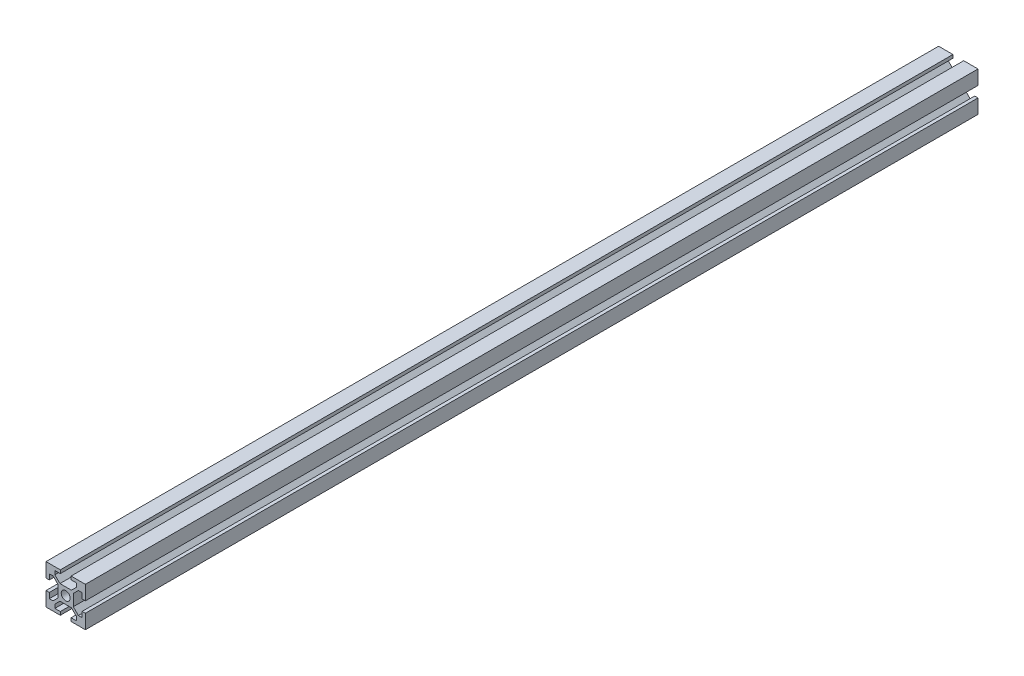
from build123d import *

# Parameters (mm, degrees)
SKETCH_1_R      = 3.4
EXTRUDE_1_DEPTH = 680


with BuildPart() as part:
    # 草图1 → 凸台-拉伸1 (new body)
    with BuildSketch(Plane.XY):
        Polygon((-4.1, 12.5), (-4.1, 15), (-8.25, 15), (-15, 15), (-15, 8.25), (-15, 4.1), (-12.5, 4.1), (-12.5, 8.25), (-9.664213562, 8.25), (-5.8, 4.385786438), (-5.8, -4.385786438), (-9.664213562, -8.25), (-12.5, -8.25), (-12.5, -4.1), (-15, -4.1), (-15, -8.25), (-15, -15), (-8.25, -15), (-4.1, -15), (-4.1, -12.5), (-8.25, -12.5), (-8.25, -9.664213562), (-4.385786438, -5.8), (4.385786438, -5.8), (8.25, -9.664213562), (8.25, -12.5), (4.1, -12.5), (4.1, -15), (8.25, -15), (15, -15), (15, -8.25), (15, -4.1), (12.5, -4.1), (12.5, -8.25), (9.664213562, -8.25), (5.8, -4.385786438), (5.8, 4.385786438), (9.664213562, 8.25), (12.5, 8.25), (12.5, 4.1), (15, 4.1), (15, 8.25), (15, 15), (8.25, 15), (4.1, 15), (4.1, 12.5), (8.25, 12.5), (8.25, 9.664213562), (4.385786438, 5.8), (-4.385786438, 5.8), (-8.25, 9.664213562), (-8.25, 12.5), align=None)
        Circle(SKETCH_1_R, mode=Mode.SUBTRACT)
    extrude(amount=EXTRUDE_1_DEPTH)


solid = part.part
